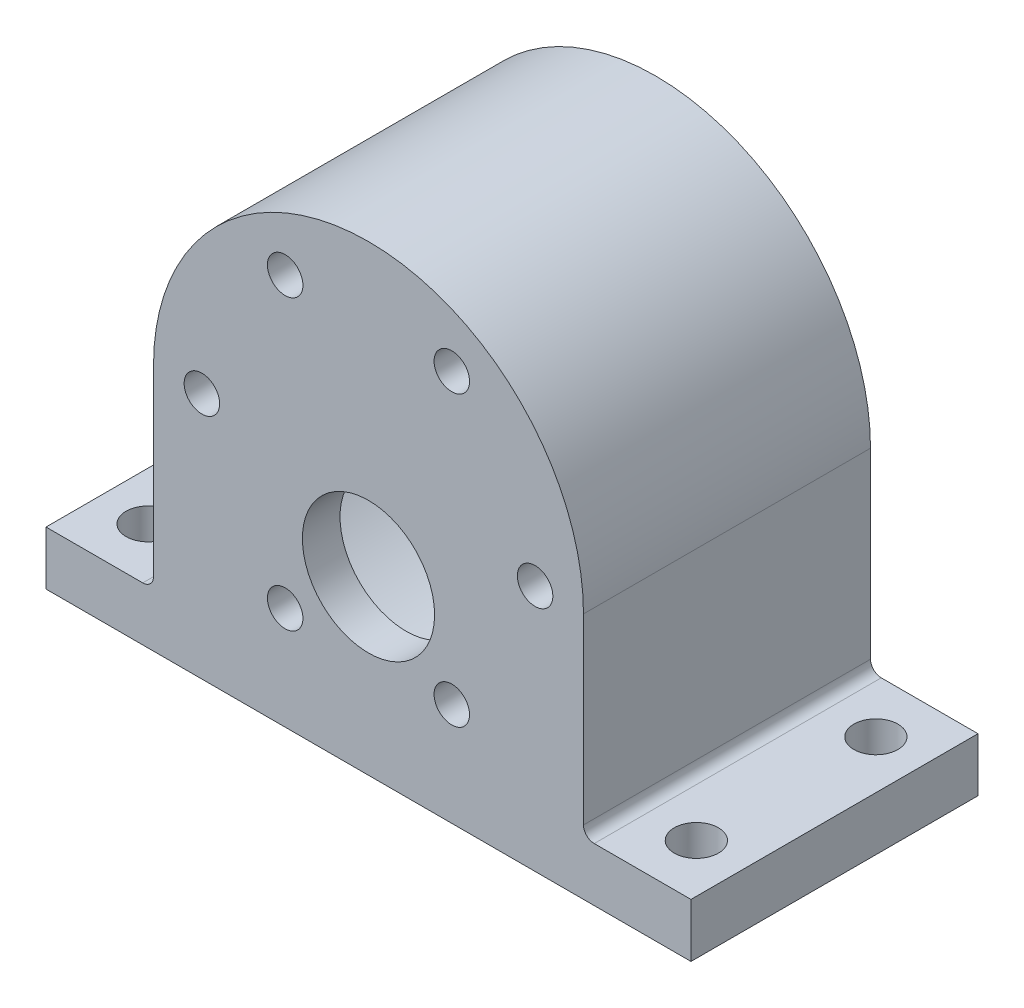
from build123d import *

# Parameters (mm, degrees)
ESQUISSE3_R             = 6.15
ESQUISSE3_R_2           = 1.65
BOSS_EXTRU_2_DEPTH      = 3.5
ESQUISSE4_R             = 18.65
BOSS_EXTRU_3_DEPTH      = 23.2
ESQUISSE5_R             = 2.05
ENL_V_MAT_EXTRU_1_DEPTH = 31


with BuildPart() as part:
    # Esquisse3 → Boss.-Extru.2 (new body)
    with BuildSketch(Plane.XY):
        with BuildLine():
            Line((-20, 0), (-20, -17))
            ThreePointArc((-20, -17), (-20.292893219, -17.707106781), (-21, -18))
            Line((-21, -18), (-30, -18))
            Line((-30, -18), (-30, -23))
            Line((-30, -23), (30, -23))
            Line((30, -23), (30, -18))
            Line((30, -18), (21, -18))
            ThreePointArc((21, -18), (20.292893219, -17.707106781), (20, -17))
            Line((20, -17), (20, 0))
            ThreePointArc((20, 0), (0, 20), (-20, 0))
        make_face()
        with Locations((0, -7)):
            Circle(ESQUISSE3_R, mode=Mode.SUBTRACT)
        with Locations((-15.5, 0)):
            Circle(ESQUISSE3_R_2, mode=Mode.SUBTRACT)
        with Locations((-7.75, 13.423393759)):
            Circle(ESQUISSE3_R_2, mode=Mode.SUBTRACT)
        with Locations((7.75, 13.423393759)):
            Circle(ESQUISSE3_R_2, mode=Mode.SUBTRACT)
        with Locations((15.5, 0)):
            Circle(ESQUISSE3_R_2, mode=Mode.SUBTRACT)
        with Locations((7.75, -13.423393759)):
            Circle(ESQUISSE3_R_2, mode=Mode.SUBTRACT)
        with Locations((-7.75, -13.423393759)):
            Circle(ESQUISSE3_R_2, mode=Mode.SUBTRACT)
    extrude(amount=-BOSS_EXTRU_2_DEPTH)

    # Esquisse4 → Boss.-Extru.3 (add)
    with BuildSketch(Plane(origin=(0, 0, -3.5), x_dir=(-1, 0, 0), z_dir=(0, 0, -1))):
        with BuildLine():
            Line((-20, 0), (-20, -17))
            ThreePointArc((-20, -17), (-20.292893219, -17.707106781), (-21, -18))
            Line((-21, -18), (-30, -18))
            Line((-30, -18), (-30, -23))
            Line((-30, -23), (30, -23))
            Line((30, -23), (30, -18))
            Line((30, -18), (21, -18))
            ThreePointArc((21, -18), (20.292893219, -17.707106781), (20, -17))
            Line((20, -17), (20, 0))
            ThreePointArc((20, 0), (0, 20), (-20, 0))
        make_face()
        Circle(ESQUISSE4_R, mode=Mode.SUBTRACT)
    extrude(amount=BOSS_EXTRU_3_DEPTH)

    # Esquisse5 → Enlèv. mat.-Extru.1 (cut)
    with BuildSketch(Plane(origin=(0, 0, 0), x_dir=(1, 0, 0), z_dir=(0, 1, 0))):
        with Locations(Location((-25.5, 21.7, 0), (0, 0, 270))):
            Circle(ESQUISSE5_R)
        with Locations(Location((-25.5, 5, 0), (0, 0, 270))):
            Circle(ESQUISSE5_R)
        with Locations(Location((25.5, 5, 0), (0, 0, 270))):
            Circle(ESQUISSE5_R)
        with Locations(Location((25.5, 21.7, 0), (0, 0, 270))):
            Circle(ESQUISSE5_R)
    extrude(amount=-ENL_V_MAT_EXTRU_1_DEPTH, mode=Mode.SUBTRACT)


solid = part.part
